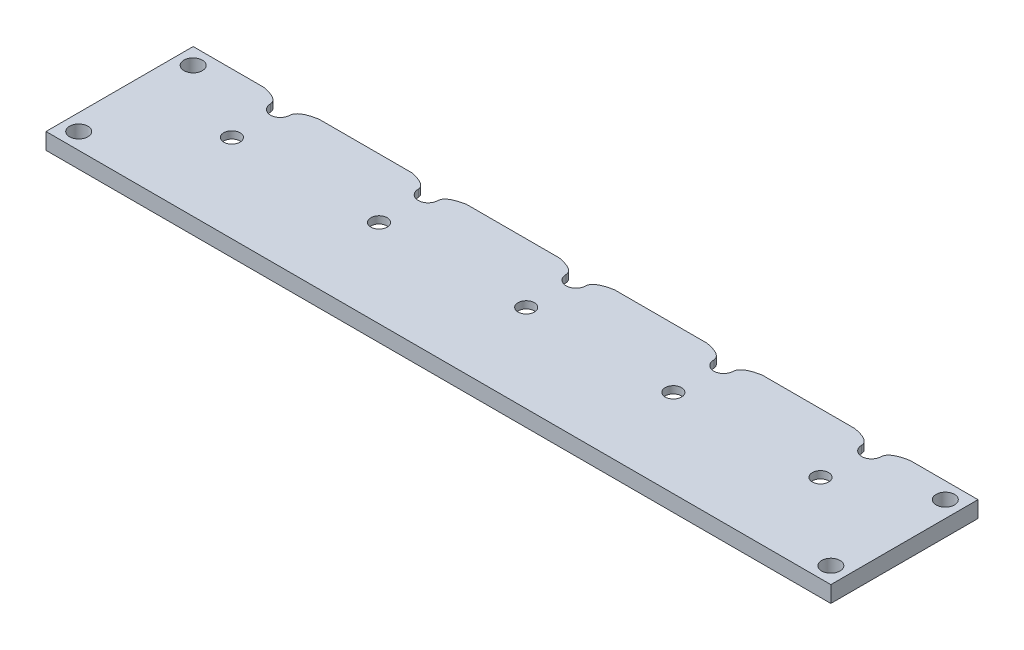
from build123d import *

# Parameters (mm, degrees)
SKETCH1_R                       = 1.5875
BOSS_EXTRUDE1_DEPTH             = 3.175
SKETCH2_R                       = 13.97
CUT_EXTRUDE1_DEPTH              = 1.778
F_9_64_0_14063_DIAMETER_HOLE1_D = 3.572002


with BuildPart() as part:
    # Sketch1 → Boss-Extrude1 (new body)
    with BuildSketch(Plane(origin=(0, 0, 0), x_dir=(1, 0, 0), z_dir=(0, 1, 0))):
        with BuildLine():
            Line((139.17898319, 28.575), (152.4, 28.575))
            Line((152.4, 28.575), (152.4, 0))
            Line((152.4, 0), (0, 0))
            Line((0, 0), (0, 28.575))
            Line((0, 28.575), (13.72901681, 28.575))
            add(Edge.make_bspline(
                [(13.72901681, 28.575), (17.042474439, 27.940707838), (17.145, 26.4414)],
                knots=[0, 0, 0, 0.606076244, 0.606076244, 0.606076244], degree=2))
            ThreePointArc((17.145, 26.4414), (19.05, 24.5364), (20.955, 26.4414))
            add(Edge.make_bspline(
                [(24.37098319, 28.575), (21.057525561, 27.940707838), (20.955, 26.4414)],
                knots=[0, 0, 0, 0.606076244, 0.606076244, 0.606076244], degree=2))
            Line((24.37098319, 28.575), (42.43101681, 28.575))
            add(Edge.make_bspline(
                [(42.43101681, 28.575), (45.744474439, 27.940707838), (45.847, 26.4414)],
                knots=[0, 0, 0, 0.606076244, 0.606076244, 0.606076244], degree=2))
            ThreePointArc((45.847, 26.4414), (47.752, 24.5364), (49.657, 26.4414))
            add(Edge.make_bspline(
                [(53.07298319, 28.575), (49.759525561, 27.940707838), (49.657, 26.4414)],
                knots=[0, 0, 0, 0.606076244, 0.606076244, 0.606076244], degree=2))
            Line((53.07298319, 28.575), (71.13301681, 28.575))
            add(Edge.make_bspline(
                [(71.13301681, 28.575), (74.446474439, 27.940707838), (74.549, 26.4414)],
                knots=[0, 0, 0, 0.606076244, 0.606076244, 0.606076244], degree=2))
            ThreePointArc((74.549, 26.4414), (76.454, 24.5364), (78.359, 26.4414))
            add(Edge.make_bspline(
                [(81.77498319, 28.575), (78.461525561, 27.940707838), (78.359, 26.4414)],
                knots=[0, 0, 0, 0.606076244, 0.606076244, 0.606076244], degree=2))
            Line((81.77498319, 28.575), (99.83501681, 28.575))
            add(Edge.make_bspline(
                [(99.83501681, 28.575), (103.148474439, 27.940707838), (103.251, 26.4414)],
                knots=[0, 0, 0, 0.606076244, 0.606076244, 0.606076244], degree=2))
            ThreePointArc((103.251, 26.4414), (105.156, 24.5364), (107.061, 26.4414))
            add(Edge.make_bspline(
                [(110.47698319, 28.575), (107.163525561, 27.940707838), (107.061, 26.4414)],
                knots=[0, 0, 0, 0.606076244, 0.606076244, 0.606076244], degree=2))
            Line((110.47698319, 28.575), (128.53701681, 28.575))
            add(Edge.make_bspline(
                [(128.53701681, 28.575), (131.850474439, 27.940707838), (131.953, 26.4414)],
                knots=[0, 0, 0, 0.606076244, 0.606076244, 0.606076244], degree=2))
            ThreePointArc((131.953, 26.4414), (133.858, 24.5364), (135.763, 26.4414))
            add(Edge.make_bspline(
                [(139.17898319, 28.575), (135.865525561, 27.940707838), (135.763, 26.4414)],
                knots=[0, 0, 0, 0.606076244, 0.606076244, 0.606076244], degree=2))
        make_face()
        with Locations(Location((19.05, 17.0434, 0), (0, 0, 270))):
            Circle(SKETCH1_R, mode=Mode.SUBTRACT)
        with Locations(Location((47.625, 17.0434, 0), (0, 0, 270))):
            Circle(SKETCH1_R, mode=Mode.SUBTRACT)
        with Locations(Location((76.2, 17.0434, 0), (0, 0, 270))):
            Circle(SKETCH1_R, mode=Mode.SUBTRACT)
        with Locations(Location((104.775, 17.0434, 0), (0, 0, 270))):
            Circle(SKETCH1_R, mode=Mode.SUBTRACT)
        with Locations(Location((133.35, 17.0434, 0), (0, 0, 270))):
            Circle(SKETCH1_R, mode=Mode.SUBTRACT)
    extrude(amount=BOSS_EXTRUDE1_DEPTH)

    # Sketch2 → Cut-Extrude1 (cut)
    with BuildSketch(Plane.XZ):
        with Locations((19.05, -17.0434)):
            Circle(SKETCH2_R)
        with Locations((47.625, -17.0434)):
            Circle(SKETCH2_R)
        with Locations((76.2, -17.0434)):
            Circle(SKETCH2_R)
        with Locations((104.775, -17.0434)):
            Circle(SKETCH2_R)
        with Locations((133.35, -17.0434)):
            Circle(SKETCH2_R)
    extrude(amount=-CUT_EXTRUDE1_DEPTH, mode=Mode.SUBTRACT)

    # 9/64 (0.14063) Diameter Hole1 (through all)
    with Locations(Plane(origin=(0, 3.175, 0), x_dir=(1, 0, 0), z_dir=(0, 1, 0))):
        with Locations((3.175, 25.4), (3.175, 3.175), (149.225, 3.175), (149.225, 25.4)):
            Hole(F_9_64_0_14063_DIAMETER_HOLE1_D / 2)


solid = part.part
